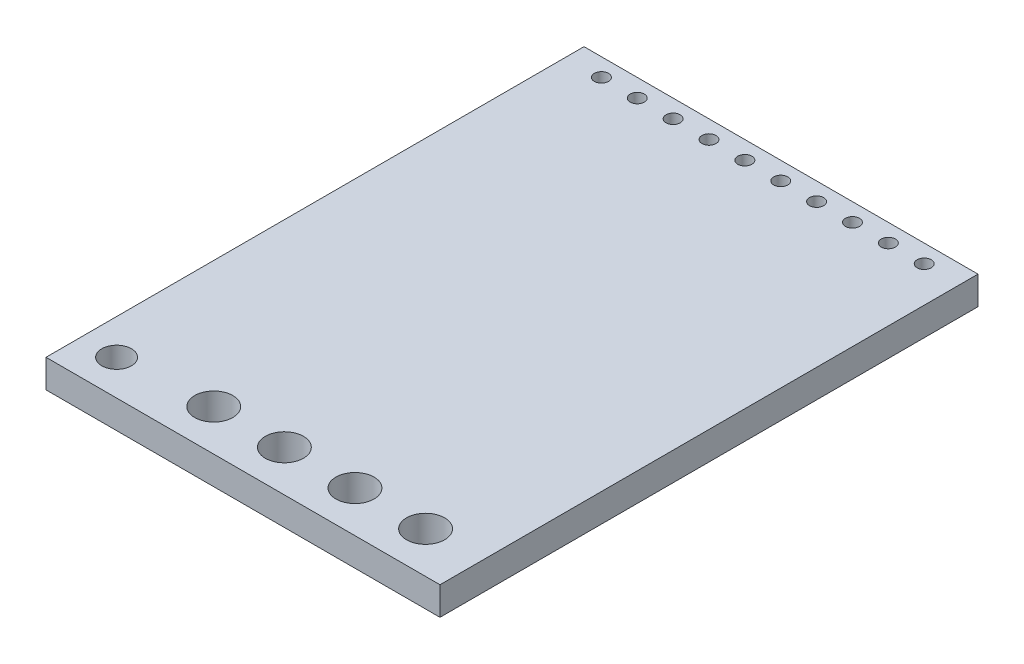
from build123d import *

# Parameters (mm, degrees)
SKETCH1_W           = 27.9
SKETCH1_H           = 38.1
SKETCH1_R           = 1.05
SKETCH1_R_2         = 0.5
SKETCH1_R_3         = 1.35
BOSS_EXTRUDE1_DEPTH = 2


with BuildPart() as part:
    # Sketch1 → Boss-Extrude1 (new body)
    with BuildSketch(Plane(origin=(0, 0, 0), x_dir=(1, 0, 0), z_dir=(0, 1, 0))):
        Rectangle(SKETCH1_W, SKETCH1_H)
        with Locations(Location((-11.45, -16.55, 0), (0, 0, 270))):
            Circle(SKETCH1_R, mode=Mode.SUBTRACT)
        with Locations(Location((11.41, 17.78, 0), (0, 0, 270))):
            Circle(SKETCH1_R_2, mode=Mode.SUBTRACT)
        with Locations(Location((8.87, 17.78, 0), (0, 0, 270))):
            Circle(SKETCH1_R_2, mode=Mode.SUBTRACT)
        with Locations(Location((6.33, 17.78, 0), (0, 0, 270))):
            Circle(SKETCH1_R_2, mode=Mode.SUBTRACT)
        with Locations(Location((3.79, 17.78, 0), (0, 0, 270))):
            Circle(SKETCH1_R_2, mode=Mode.SUBTRACT)
        with Locations(Location((1.25, 17.78, 0), (0, 0, 270))):
            Circle(SKETCH1_R_2, mode=Mode.SUBTRACT)
        with Locations(Location((-1.29, 17.78, 0), (0, 0, 270))):
            Circle(SKETCH1_R_2, mode=Mode.SUBTRACT)
        with Locations(Location((-3.83, 17.78, 0), (0, 0, 270))):
            Circle(SKETCH1_R_2, mode=Mode.SUBTRACT)
        with Locations(Location((-6.37, 17.78, 0), (0, 0, 270))):
            Circle(SKETCH1_R_2, mode=Mode.SUBTRACT)
        with Locations(Location((-8.91, 17.78, 0), (0, 0, 270))):
            Circle(SKETCH1_R_2, mode=Mode.SUBTRACT)
        with Locations(Location((-11.45, 17.78, 0), (0, 0, 270))):
            Circle(SKETCH1_R_2, mode=Mode.SUBTRACT)
        with Locations(Location((10.01, -16.13, 0), (0, 0, 270))):
            Circle(SKETCH1_R_3, mode=Mode.SUBTRACT)
        with Locations(Location((5.01, -16.13, 0), (0, 0, 270))):
            Circle(SKETCH1_R_3, mode=Mode.SUBTRACT)
        with Locations(Location((0.01, -16.13, 0), (0, 0, 270))):
            Circle(SKETCH1_R_3, mode=Mode.SUBTRACT)
        with Locations(Location((-4.99, -16.13, 0), (0, 0, 270))):
            Circle(SKETCH1_R_3, mode=Mode.SUBTRACT)
    extrude(amount=BOSS_EXTRUDE1_DEPTH)


solid = part.part
